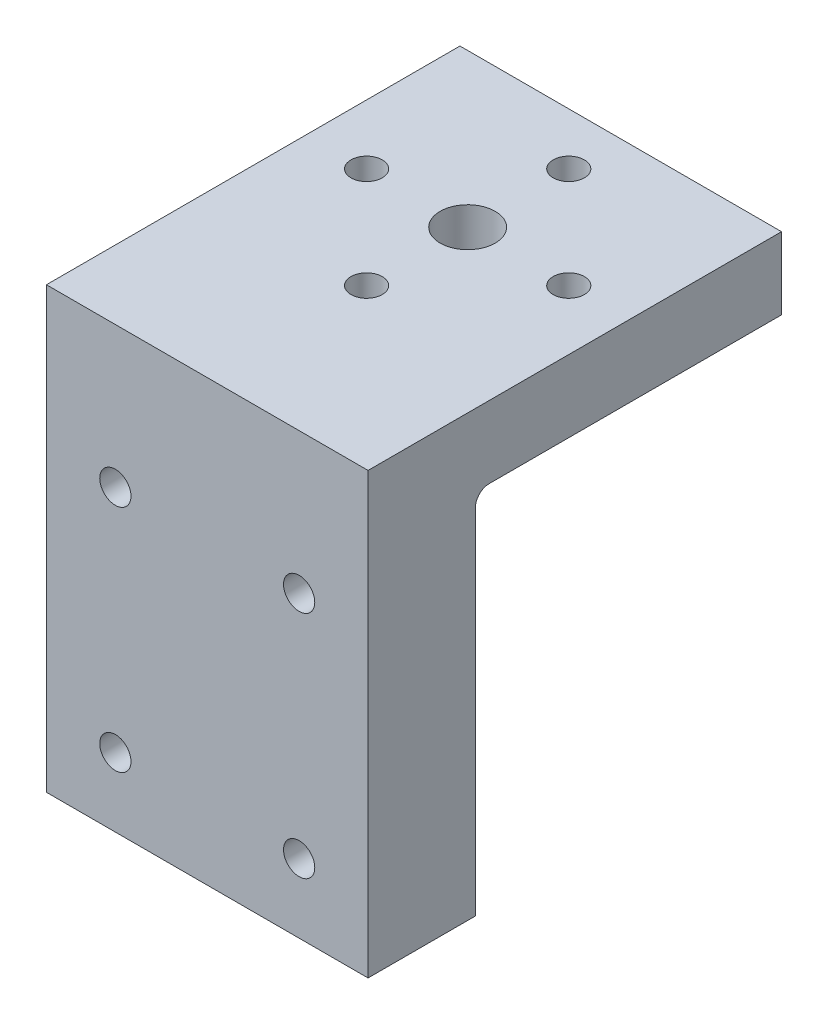
from build123d import *

# Parameters (mm, degrees)
SKETCH1_W           = 35
SKETCH1_H           = 45
BOSS_EXTRUDE1_DEPTH = 7.838444594
SKETCH2_W           = 35
SKETCH2_H           = 11.6848633
BOSS_EXTRUDE2_DEPTH = 40
SKETCH3_R           = 9
CUT_EXTRUDE1_DEPTH  = 2
SKETCH4_R           = 3
SKETCH4_R_2         = 1.7
CUT_EXTRUDE2_DEPTH  = 7.838444594
SKETCH5_R           = 1.7
CUT_EXTRUDE3_DEPTH  = 11.6848633
FILLET1_R           = 1.5


with BuildPart() as part:
    # Sketch1 → Boss-Extrude1 (new body)
    with BuildSketch(Plane(origin=(0, 0, 0), x_dir=(1, 0, 0), z_dir=(0, 1, 0))):
        Rectangle(SKETCH1_W, SKETCH1_H)
    extrude(amount=-BOSS_EXTRUDE1_DEPTH)

    # Sketch2 → Boss-Extrude2 (add)
    with BuildSketch(Plane.XZ.offset(7.838444594)):
        with Locations((0, 16.65756835)):
            Rectangle(SKETCH2_W, SKETCH2_H)
    extrude(amount=BOSS_EXTRUDE2_DEPTH)

    # Sketch3 → Cut-Extrude1 (cut)
    with BuildSketch(Plane.XZ.offset(7.838444594)):
        with Locations(Location((0, -5.84243165, 0), (0, 0, 270))):
            Circle(SKETCH3_R)
    extrude(amount=-CUT_EXTRUDE1_DEPTH, mode=Mode.SUBTRACT)

    # Sketch4 → Cut-Extrude2 (cut)
    with BuildSketch(Plane.XZ.offset(7.838444594)):
        with Locations(Location((0, -5.84243165, 0), (0, 0, 270))):
            Circle(SKETCH4_R)
        with Locations(Location((0, 5.15756835, 0), (0, 0, 270))):
            Circle(SKETCH4_R_2)
        with Locations(Location((11, -5.84243165, 0), (0, 0, 270))):
            Circle(SKETCH4_R_2)
        with Locations(Location((0, -16.84243165, 0), (0, 0, 270))):
            Circle(SKETCH4_R_2)
        with Locations(Location((-11, -5.84243165, 0), (0, 0, 270))):
            Circle(SKETCH4_R_2)
    extrude(amount=-CUT_EXTRUDE2_DEPTH, mode=Mode.SUBTRACT)

    # Sketch5 → Cut-Extrude3 (cut)
    with BuildSketch(Plane(origin=(0, 0, 10.8151367), x_dir=(-1, 0, 0), z_dir=(0, 0, -1))):
        with Locations((-10, -40.338444594)):
            Circle(SKETCH5_R)
        with Locations((10, -40.338444594)):
            Circle(SKETCH5_R)
        with Locations((-10, -15.338444594)):
            Circle(SKETCH5_R)
        with Locations((10, -15.338444594)):
            Circle(SKETCH5_R)
    extrude(amount=-CUT_EXTRUDE3_DEPTH, mode=Mode.SUBTRACT)

    # Fillet1
    fillet1_edges = [part.edges().sort_by_distance(p)[0] for p in [
        (0, -7.838444594, 10.8151367),
    ]]
    fillet(fillet1_edges, radius=FILLET1_R)


solid = part.part
